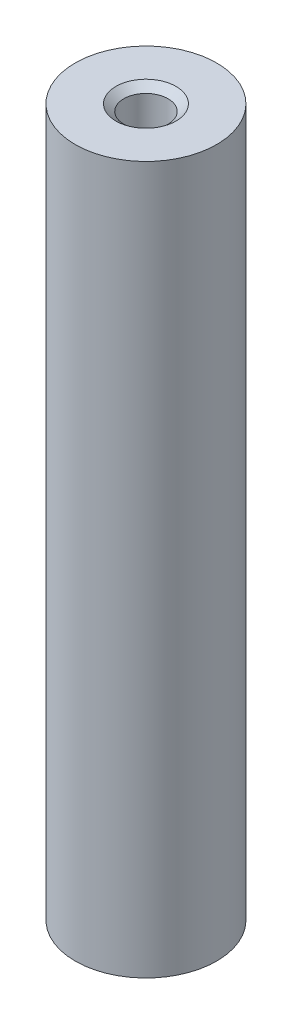
from build123d import *

# Parameters (mm, degrees)
SKETCH1_R                         = 12.7
BOSS_EXTRUDE1_DEPTH               = 127
F_1_2_13_TAPPED_HOLE1_D           = 10.71626
F_1_2_13_TAPPED_HOLE1_DEPTH       = 25.4
F_1_2_13_TAPPED_HOLE1_CSINK_D     = 13.97
F_1_2_13_TAPPED_HOLE1_CSINK_ANGLE = 100
F_1_2_13_TAPPED_HOLE1_TIP         = 3.219489309
F_3_8_16_TAPPED_HOLE1_D           = 7.9375
F_3_8_16_TAPPED_HOLE1_DEPTH       = 25.4
F_3_8_16_TAPPED_HOLE1_CSINK_D     = 10.795
F_3_8_16_TAPPED_HOLE1_CSINK_ANGLE = 100
F_3_8_16_TAPPED_HOLE1_TIP         = 2.384665582


with BuildPart() as part:
    # Sketch1 → Boss-Extrude1 (new body)
    with BuildSketch(Plane(origin=(0, 0, 0), x_dir=(1, 0, 0), z_dir=(0, 1, 0))):
        with Locations(Location((0, 0, 0), (0, 0, 270))):
            Circle(SKETCH1_R)
    extrude(amount=BOSS_EXTRUDE1_DEPTH)

    # 1/2-13 Tapped Hole1
    with Locations(Plane(origin=(0, 0, 0), x_dir=(-1, 0, 0), z_dir=(0, -1, 0))):
        with Locations((0, 0)):
            CounterSinkHole(F_1_2_13_TAPPED_HOLE1_D / 2, F_1_2_13_TAPPED_HOLE1_CSINK_D / 2, depth=F_1_2_13_TAPPED_HOLE1_DEPTH, counter_sink_angle=F_1_2_13_TAPPED_HOLE1_CSINK_ANGLE)
            with Locations((0, 0, -(F_1_2_13_TAPPED_HOLE1_DEPTH + F_1_2_13_TAPPED_HOLE1_TIP / 2))):  # 118° drill point
                Cone(0, F_1_2_13_TAPPED_HOLE1_D / 2, F_1_2_13_TAPPED_HOLE1_TIP, mode=Mode.SUBTRACT)

    # 3/8-16 Tapped Hole1
    with Locations(Plane(origin=(0, 127, 0), x_dir=(1, 0, 0), z_dir=(0, 1, 0))):
        with Locations((0, 0)):
            CounterSinkHole(F_3_8_16_TAPPED_HOLE1_D / 2, F_3_8_16_TAPPED_HOLE1_CSINK_D / 2, depth=F_3_8_16_TAPPED_HOLE1_DEPTH, counter_sink_angle=F_3_8_16_TAPPED_HOLE1_CSINK_ANGLE)
            with Locations((0, 0, -(F_3_8_16_TAPPED_HOLE1_DEPTH + F_3_8_16_TAPPED_HOLE1_TIP / 2))):  # 118° drill point
                Cone(0, F_3_8_16_TAPPED_HOLE1_D / 2, F_3_8_16_TAPPED_HOLE1_TIP, mode=Mode.SUBTRACT)


solid = part.part
